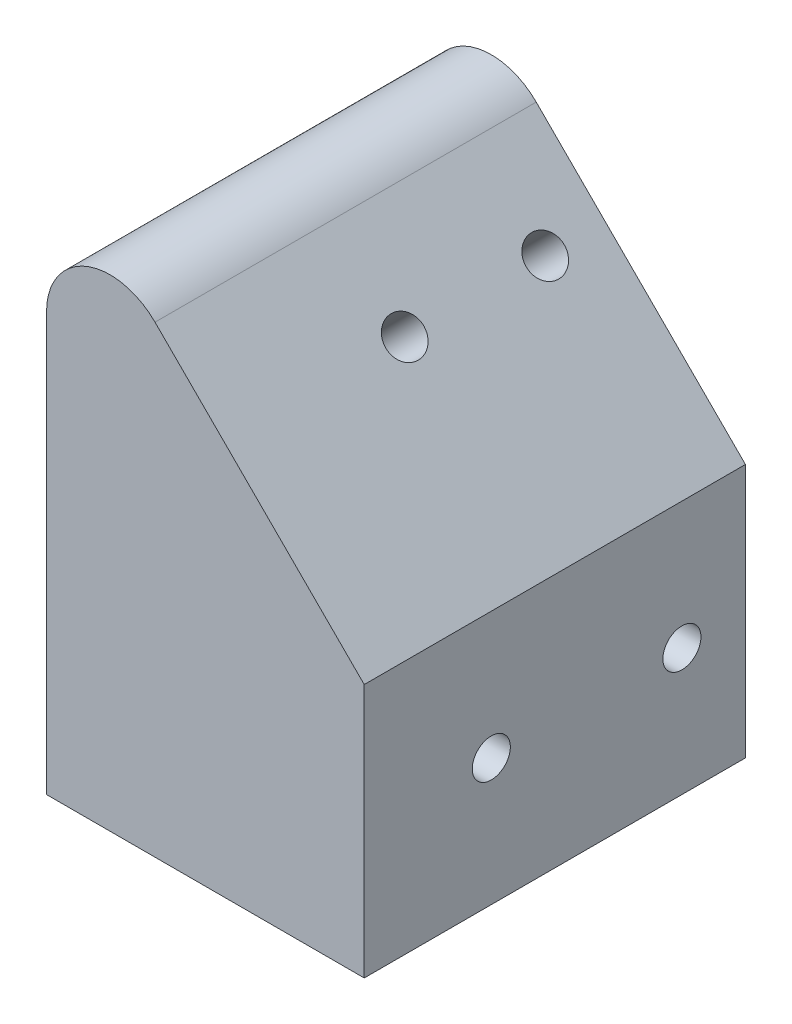
from build123d import *

# Parameters (mm, degrees)
CROQUIS2_W              = 30
CROQUIS2_H              = 20
SALIENTE_EXTRUIR2_DEPTH = 25
SALIENTE_EXTRUIR3_DEPTH = 30
REDONDEO1_R             = 5
CROQUIS8_R              = 1.5
CORTAR_EXTRUIR5_DEPTH   = 44.874821937
CROQUIS9_R              = 1.5
CORTAR_EXTRUIR6_DEPTH   = 46.961940777


with BuildPart() as part:
    # Croquis2 → Saliente-Extruir2 (new body)
    with BuildSketch(Plane(origin=(0, 0, 0), x_dir=(0, 0, -1), z_dir=(1, 0, 0))):
        with Locations((-15, -10)):
            Rectangle(CROQUIS2_W, CROQUIS2_H)
    extrude(amount=SALIENTE_EXTRUIR2_DEPTH)

    # Croquis3 → Saliente-Extruir3 (add, through all)
    with BuildSketch(Plane(origin=(0, 0, 0), x_dir=(-1, 0, 0), z_dir=(0, 0, -1))):
        Polygon((0, 0), (0, 25), (-25, 0), align=None)
    extrude(amount=-SALIENTE_EXTRUIR3_DEPTH)

    # Redondeo1
    redondeo1_edges = [part.edges().sort_by_distance(p)[0] for p in [
        (0, 25, 15),
    ]]
    fillet(redondeo1_edges, radius=REDONDEO1_R)

    # Croquis8 → Cortar-Extruir5 (cut, through all)
    with BuildSketch(Plane.ZY):
        with Locations((20, -10)):
            Circle(CROQUIS8_R)
        with Locations((5, -10)):
            Circle(CROQUIS8_R)
    extrude(amount=-CORTAR_EXTRUIR5_DEPTH, mode=Mode.SUBTRACT)

    # Croquis9 → Cortar-Extruir6 (cut, through all)
    with BuildSketch(Plane(origin=(12.5, 12.5, 0), x_dir=(0, 0, -1), z_dir=(0.707106781186544, 0.7071067811865511, 0))):
        with Locations(Location((-15.763055683, -2.050053866, 0), (0, 0, 90))):
            Circle(CROQUIS9_R)
        with Locations(Location((-4.707092624, -2.050053866, 0), (0, 0, 90))):
            Circle(CROQUIS9_R)
    extrude(amount=-CORTAR_EXTRUIR6_DEPTH, mode=Mode.SUBTRACT)


solid = part.part
